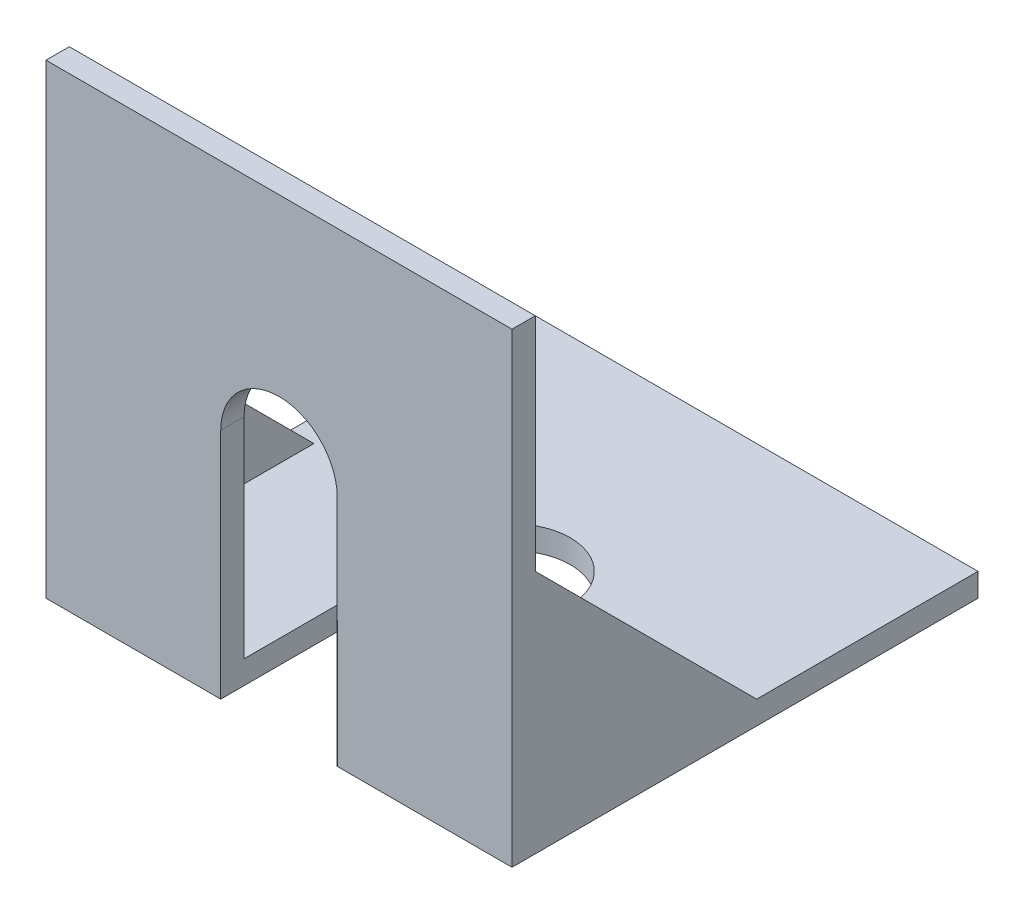
from build123d import *

# Parameters (mm, degrees)
SKETCH1_W           = 20
SKETCH1_H           = 20
SKETCH1_R           = 2.5
BOSS_EXTRUDE1_DEPTH = 1
SKETCH2_W           = 20
SKETCH2_H           = 20
SKETCH2_R           = 2.5
BOSS_EXTRUDE2_DEPTH = 1
BOSS_EXTRUDE3_DEPTH = 1
BOSS_EXTRUDE4_START = -19
BOSS_EXTRUDE4_DEPTH = 1
SKETCH5_W           = 5
SKETCH5_H           = 9
CUT_EXTRUDE1_DEPTH  = 24.685438565
SKETCH4_W           = 5
SKETCH4_H           = 10
CUT_EXTRUDE2_DEPTH  = 30.342801502


with BuildPart() as part:
    # Sketch1 → Boss-Extrude1 (new body)
    with BuildSketch(Plane(origin=(0, 0, 0), x_dir=(1, 0, 0), z_dir=(0, 1, 0))):
        Rectangle(SKETCH1_W, SKETCH1_H)
        Circle(SKETCH1_R, mode=Mode.SUBTRACT)
    extrude(amount=BOSS_EXTRUDE1_DEPTH)

    # Sketch2 → Boss-Extrude2 (add)
    with BuildSketch(Plane.XY.offset(10)):
        with Locations((0, 10)):
            Rectangle(SKETCH2_W, SKETCH2_H)
        with Locations((0, 10)):
            Circle(SKETCH2_R, mode=Mode.SUBTRACT)
    extrude(amount=-BOSS_EXTRUDE2_DEPTH)

    # Sketch3 → Boss-Extrude3 (add)
    with BuildSketch(Plane(origin=(10, 0, 0), x_dir=(0, 0, -1), z_dir=(1, 0, 0))):
        Polygon((-9, 10.5), (0.5, 1), (-9, 1), align=None)
    extrude(amount=-BOSS_EXTRUDE3_DEPTH)

    # Sketch3<2> → Boss-Extrude4 (add)
    with BuildSketch(Plane(origin=(10, 0, 0), x_dir=(0, 0, -1), z_dir=(1, 0, 0)).offset(BOSS_EXTRUDE4_START)):
        Polygon((-9, 10.5), (0.5, 1), (-9, 1), align=None)
    extrude(amount=-BOSS_EXTRUDE4_DEPTH)

    # Sketch5 → Cut-Extrude1 (cut, through all)
    with BuildSketch(Plane(origin=(0, 1, 0), x_dir=(1, 0, 0), z_dir=(0, 1, 0))):
        with Locations((0, -4.5)):
            Rectangle(SKETCH5_W, SKETCH5_H)
    extrude(amount=-CUT_EXTRUDE1_DEPTH, mode=Mode.SUBTRACT)

    # Sketch4 → Cut-Extrude2 (cut, through all)
    with BuildSketch(Plane(origin=(0, 0, 9), x_dir=(-1, 0, 0), z_dir=(0, 0, -1))):
        with Locations((0, 5)):
            Rectangle(SKETCH4_W, SKETCH4_H)
    extrude(amount=-CUT_EXTRUDE2_DEPTH, mode=Mode.SUBTRACT)


solid = part.part
